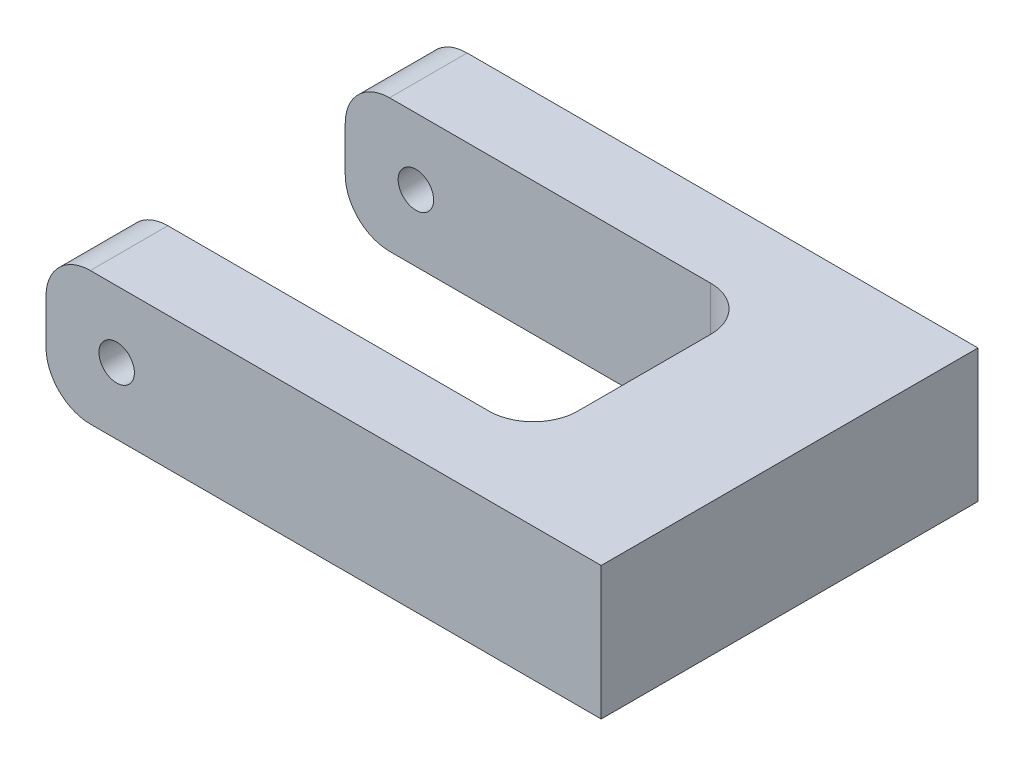
from build123d import *

# Parameters (mm, degrees)
EXTRUDE_START       = 7.5
EXTRUDE_1_DEPTH     = 85
SKETCH_3_W          = 94.594294475
SKETCH_3_H          = 50
CUT_EXTRUDE_1_DEPTH = 43.5
SKETCH_4_R          = 4
CUT_EXTRUDE_2_DEPTH = 100
FILLET_1_R          = 10


with BuildPart() as part:
    # Эскиз1 → Вытянуть1 (new body)
    with BuildSketch(Plane.XY.offset(EXTRUDE_START)):
        with BuildLine():
            Line((-0.114856082, -4.041900761), (-0.114856082, -14.041900761))
            ThreePointArc((-0.114856082, -14.041900761), (2.814076106, -21.112968573), (9.885143918, -24.041900761))
            Line((9.885143918, -24.041900761), (125.131658012, -24.041900761))
            Line((125.131658012, -24.041900761), (125.131658012, 5.958099239))
            Line((125.131658012, 5.958099239), (9.885143918, 5.958099239))
            ThreePointArc((9.885143918, 5.958099239), (2.814076106, 3.02916705), (-0.114856082, -4.041900761))
        make_face()
    extrude(amount=-EXTRUDE_1_DEPTH)

    # Эскиз3 → Вырез-Вытянуть1 (cut, symmetric)
    with BuildSketch(Plane(origin=(0, 0, 0), x_dir=(1, 0, 0), z_dir=(0, 1, 0))):
        with Locations((45.031047777, 35)):
            Rectangle(SKETCH_3_W, SKETCH_3_H)
    extrude(amount=CUT_EXTRUDE_1_DEPTH, both=True, mode=Mode.SUBTRACT)

    # Эскиз4 → Вырез-Вытянуть2 (cut, symmetric)
    with BuildSketch(Plane.XY):
        with Locations((15.823953055, -9.041900761)):
            Circle(SKETCH_4_R)
    extrude(amount=CUT_EXTRUDE_2_DEPTH, both=True, mode=Mode.SUBTRACT)

    # Скругление1
    fillet_1_edges = [part.edges().sort_by_distance(p)[0] for p in [
        (92.328195015, -9.041900761, -60),
        (92.328195015, -9.041900761, -10),
    ]]
    fillet(fillet_1_edges, radius=FILLET_1_R)


solid = part.part
